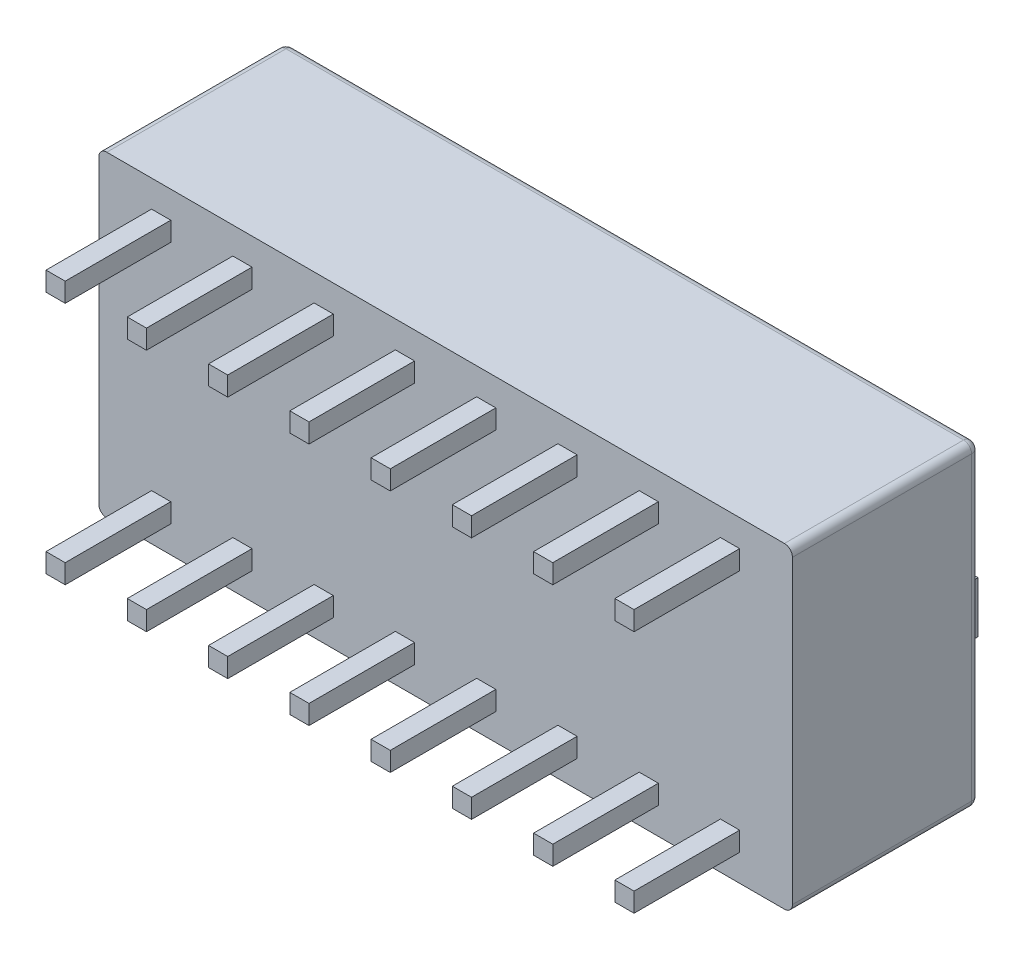
from build123d import *

# Parameters (mm, degrees)
IZIM1_W                       = 21.68
IZIM1_H                       = 9.9
Y_KSEKLIK_EKSTR_ZYON1_DEPTH   = 5.85
IZIM2_W                       = 1.4
IZIM2_H                       = 3.2
KES_EKSTR_ZYON1_DEPTH         = 1
IZIM3_W                       = 1.4
IZIM3_H                       = 1.6
Y_KSEKLIK_EKSTR_ZYON2_DEPTH   = 2.2
Y_KSEKLIK_EKSTR_ZYON2_2_DEPTH = 2.2
Y_KSEKLIK_EKSTR_ZYON2_3_DEPTH = 2.2
Y_KSEKLIK_EKSTR_ZYON2_4_DEPTH = 2.2
Y_KSEKLIK_EKSTR_ZYON2_5_DEPTH = 2.2
Y_KSEKLIK_EKSTR_ZYON2_6_DEPTH = 2.2
Y_KSEKLIK_EKSTR_ZYON2_7_DEPTH = 2.2
Y_KSEKLIK_EKSTR_ZYON2_8_DEPTH = 2.2
IZIM4_W                       = 1.4
IZIM4_H                       = 1.6
Y_KSEKLIK_EKSTR_ZYON3_DEPTH   = 0.9
Y_KSEKLIK_EKSTR_ZYON3_2_DEPTH = 0.9
Y_KSEKLIK_EKSTR_ZYON3_3_DEPTH = 0.9
Y_KSEKLIK_EKSTR_ZYON3_4_DEPTH = 0.9
Y_KSEKLIK_EKSTR_ZYON3_5_DEPTH = 0.9
Y_KSEKLIK_EKSTR_ZYON3_6_DEPTH = 0.9
Y_KSEKLIK_EKSTR_ZYON3_7_DEPTH = 0.9
Y_KSEKLIK_EKSTR_ZYON3_8_DEPTH = 0.9
RADYUS1_R                     = 0.25
IZIM5_W                       = 0.6
IZIM5_H                       = 0.6
Y_KSEKLIK_EKSTR_ZYON4_DEPTH   = 3.3


with BuildPart() as part:
    # Çizim1 → Yükseklik-Ekstrüzyon1 (new body)
    with BuildSketch(Plane.XY):
        Rectangle(IZIM1_W, IZIM1_H)
    extrude(amount=Y_KSEKLIK_EKSTR_ZYON1_DEPTH)

    # Çizim2 → Kes-Ekstrüzyon1 (cut)
    with BuildSketch(Plane(origin=(0, 0, 0), x_dir=(-1, 0, 0), z_dir=(0, 0, -1))):
        with Locations((-8.89, 0)):
            Rectangle(IZIM2_W, IZIM2_H)
        with Locations((-6.35, 0)):
            Rectangle(IZIM2_W, IZIM2_H)
        with Locations((-3.81, 0)):
            Rectangle(IZIM2_W, IZIM2_H)
        with Locations((-1.27, 0)):
            Rectangle(IZIM2_W, IZIM2_H)
        with Locations((1.27, 0)):
            Rectangle(IZIM2_W, IZIM2_H)
        with Locations((3.81, 0)):
            Rectangle(IZIM2_W, IZIM2_H)
        with Locations((6.35, 0)):
            Rectangle(IZIM2_W, IZIM2_H)
        with Locations((8.89, 0)):
            Rectangle(IZIM2_W, IZIM2_H)
    extrude(amount=-KES_EKSTR_ZYON1_DEPTH, mode=Mode.SUBTRACT)

    # Radyus1
    radyus1_edges = [part.edges().sort_by_distance(p)[0] for p in [
        (-10.84, 0, 0),
        (0, 4.95, 0),
        (10.84, 0, 0),
        (0, -4.95, 0),
        (-10.84, -4.95, 2.925),
        (-10.84, 4.95, 2.925),
        (10.84, 4.95, 2.925),
        (10.84, -4.95, 2.925),
    ]]
    fillet(radyus1_edges, radius=RADYUS1_R)

    # Çizim5 → Yükseklik-Ekstrüzyon4 (add)
    with BuildSketch(Plane.XY.offset(5.85)):
        with Locations((-8.89, 3.81)):
            Rectangle(IZIM5_W, IZIM5_H)
        with Locations((-6.35, 3.81)):
            Rectangle(IZIM5_W, IZIM5_H)
        with Locations((-3.81, 3.81)):
            Rectangle(IZIM5_W, IZIM5_H)
        with Locations((-1.27, 3.81)):
            Rectangle(IZIM5_W, IZIM5_H)
        with Locations((1.27, 3.81)):
            Rectangle(IZIM5_W, IZIM5_H)
        with Locations((3.81, 3.81)):
            Rectangle(IZIM5_W, IZIM5_H)
        with Locations((6.35, 3.81)):
            Rectangle(IZIM5_W, IZIM5_H)
        with Locations((8.89, 3.81)):
            Rectangle(IZIM5_W, IZIM5_H)
        with Locations((8.89, -3.81)):
            Rectangle(IZIM5_W, IZIM5_H)
        with Locations((6.35, -3.81)):
            Rectangle(IZIM5_W, IZIM5_H)
        with Locations((3.81, -3.81)):
            Rectangle(IZIM5_W, IZIM5_H)
        with Locations((1.27, -3.81)):
            Rectangle(IZIM5_W, IZIM5_H)
        with Locations((-1.27, -3.81)):
            Rectangle(IZIM5_W, IZIM5_H)
        with Locations((-3.81, -3.81)):
            Rectangle(IZIM5_W, IZIM5_H)
        with Locations((-6.35, -3.81)):
            Rectangle(IZIM5_W, IZIM5_H)
        with Locations((-8.89, -3.81)):
            Rectangle(IZIM5_W, IZIM5_H)
    extrude(amount=Y_KSEKLIK_EKSTR_ZYON4_DEPTH)


with BuildPart() as body_2:
    # Çizim3 → Yükseklik-Ekstrüzyon2 (new body)
    with BuildSketch(Plane(origin=(0, 0, 1), x_dir=(-1, 0, 0), z_dir=(0, 0, -1))):
        with Locations((-8.89, -0.8)):
            Rectangle(IZIM3_W, IZIM3_H)
    extrude(amount=Y_KSEKLIK_EKSTR_ZYON2_DEPTH)


with BuildPart() as body_3:
    # Çizim3 → Y_kseklik-Ekstr_zyon2 2 (new body)
    with BuildSketch(Plane(origin=(0, 0, 1), x_dir=(-1, 0, 0), z_dir=(0, 0, -1))):
        with Locations((-6.35, -0.8)):
            Rectangle(IZIM3_W, IZIM3_H)
    extrude(amount=Y_KSEKLIK_EKSTR_ZYON2_2_DEPTH)


with BuildPart() as body_4:
    # Çizim3 → Y_kseklik-Ekstr_zyon2 3 (new body)
    with BuildSketch(Plane(origin=(0, 0, 1), x_dir=(-1, 0, 0), z_dir=(0, 0, -1))):
        with Locations((-3.81, -0.8)):
            Rectangle(IZIM3_W, IZIM3_H)
    extrude(amount=Y_KSEKLIK_EKSTR_ZYON2_3_DEPTH)


with BuildPart() as body_5:
    # Çizim3 → Y_kseklik-Ekstr_zyon2 4 (new body)
    with BuildSketch(Plane(origin=(0, 0, 1), x_dir=(-1, 0, 0), z_dir=(0, 0, -1))):
        with Locations((-1.27, -0.8)):
            Rectangle(IZIM3_W, IZIM3_H)
    extrude(amount=Y_KSEKLIK_EKSTR_ZYON2_4_DEPTH)


with BuildPart() as body_6:
    # Çizim3 → Y_kseklik-Ekstr_zyon2 5 (new body)
    with BuildSketch(Plane(origin=(0, 0, 1), x_dir=(-1, 0, 0), z_dir=(0, 0, -1))):
        with Locations((1.27, -0.8)):
            Rectangle(IZIM3_W, IZIM3_H)
    extrude(amount=Y_KSEKLIK_EKSTR_ZYON2_5_DEPTH)


with BuildPart() as body_7:
    # Çizim3 → Y_kseklik-Ekstr_zyon2 6 (new body)
    with BuildSketch(Plane(origin=(0, 0, 1), x_dir=(-1, 0, 0), z_dir=(0, 0, -1))):
        with Locations((3.81, -0.8)):
            Rectangle(IZIM3_W, IZIM3_H)
    extrude(amount=Y_KSEKLIK_EKSTR_ZYON2_6_DEPTH)


with BuildPart() as body_8:
    # Çizim3 → Y_kseklik-Ekstr_zyon2 7 (new body)
    with BuildSketch(Plane(origin=(0, 0, 1), x_dir=(-1, 0, 0), z_dir=(0, 0, -1))):
        with Locations((6.35, -0.8)):
            Rectangle(IZIM3_W, IZIM3_H)
    extrude(amount=Y_KSEKLIK_EKSTR_ZYON2_7_DEPTH)


with BuildPart() as body_9:
    # Çizim3 → Y_kseklik-Ekstr_zyon2 8 (new body)
    with BuildSketch(Plane(origin=(0, 0, 1), x_dir=(-1, 0, 0), z_dir=(0, 0, -1))):
        with Locations((8.89, -0.8)):
            Rectangle(IZIM3_W, IZIM3_H)
    extrude(amount=Y_KSEKLIK_EKSTR_ZYON2_8_DEPTH)


with BuildPart() as body_10:
    # Çizim4 → Yükseklik-Ekstrüzyon3 (new body)
    with BuildSketch(Plane(origin=(0, 0, 1), x_dir=(-1, 0, 0), z_dir=(0, 0, -1))):
        with Locations((-8.89, 0.8)):
            Rectangle(IZIM4_W, IZIM4_H)
    extrude(amount=Y_KSEKLIK_EKSTR_ZYON3_DEPTH)


with BuildPart() as body_11:
    # Çizim4 → Y_kseklik-Ekstr_zyon3 2 (new body)
    with BuildSketch(Plane(origin=(0, 0, 1), x_dir=(-1, 0, 0), z_dir=(0, 0, -1))):
        with Locations((-6.35, 0.8)):
            Rectangle(IZIM4_W, IZIM4_H)
    extrude(amount=Y_KSEKLIK_EKSTR_ZYON3_2_DEPTH)


with BuildPart() as body_12:
    # Çizim4 → Y_kseklik-Ekstr_zyon3 3 (new body)
    with BuildSketch(Plane(origin=(0, 0, 1), x_dir=(-1, 0, 0), z_dir=(0, 0, -1))):
        with Locations((-3.81, 0.8)):
            Rectangle(IZIM4_W, IZIM4_H)
    extrude(amount=Y_KSEKLIK_EKSTR_ZYON3_3_DEPTH)


with BuildPart() as body_13:
    # Çizim4 → Y_kseklik-Ekstr_zyon3 4 (new body)
    with BuildSketch(Plane(origin=(0, 0, 1), x_dir=(-1, 0, 0), z_dir=(0, 0, -1))):
        with Locations((-1.27, 0.8)):
            Rectangle(IZIM4_W, IZIM4_H)
    extrude(amount=Y_KSEKLIK_EKSTR_ZYON3_4_DEPTH)


with BuildPart() as body_14:
    # Çizim4 → Y_kseklik-Ekstr_zyon3 5 (new body)
    with BuildSketch(Plane(origin=(0, 0, 1), x_dir=(-1, 0, 0), z_dir=(0, 0, -1))):
        with Locations((1.27, 0.8)):
            Rectangle(IZIM4_W, IZIM4_H)
    extrude(amount=Y_KSEKLIK_EKSTR_ZYON3_5_DEPTH)


with BuildPart() as body_15:
    # Çizim4 → Y_kseklik-Ekstr_zyon3 6 (new body)
    with BuildSketch(Plane(origin=(0, 0, 1), x_dir=(-1, 0, 0), z_dir=(0, 0, -1))):
        with Locations((3.81, 0.8)):
            Rectangle(IZIM4_W, IZIM4_H)
    extrude(amount=Y_KSEKLIK_EKSTR_ZYON3_6_DEPTH)


with BuildPart() as body_16:
    # Çizim4 → Y_kseklik-Ekstr_zyon3 7 (new body)
    with BuildSketch(Plane(origin=(0, 0, 1), x_dir=(-1, 0, 0), z_dir=(0, 0, -1))):
        with Locations((6.35, 0.8)):
            Rectangle(IZIM4_W, IZIM4_H)
    extrude(amount=Y_KSEKLIK_EKSTR_ZYON3_7_DEPTH)


with BuildPart() as body_17:
    # Çizim4 → Y_kseklik-Ekstr_zyon3 8 (new body)
    with BuildSketch(Plane(origin=(0, 0, 1), x_dir=(-1, 0, 0), z_dir=(0, 0, -1))):
        with Locations((8.89, 0.8)):
            Rectangle(IZIM4_W, IZIM4_H)
    extrude(amount=Y_KSEKLIK_EKSTR_ZYON3_8_DEPTH)


solid = Compound([part.part, body_2.part, body_3.part, body_4.part, body_5.part, body_6.part, body_7.part, body_8.part, body_9.part, body_10.part, body_11.part, body_12.part, body_13.part, body_14.part, body_15.part, body_16.part, body_17.part])
